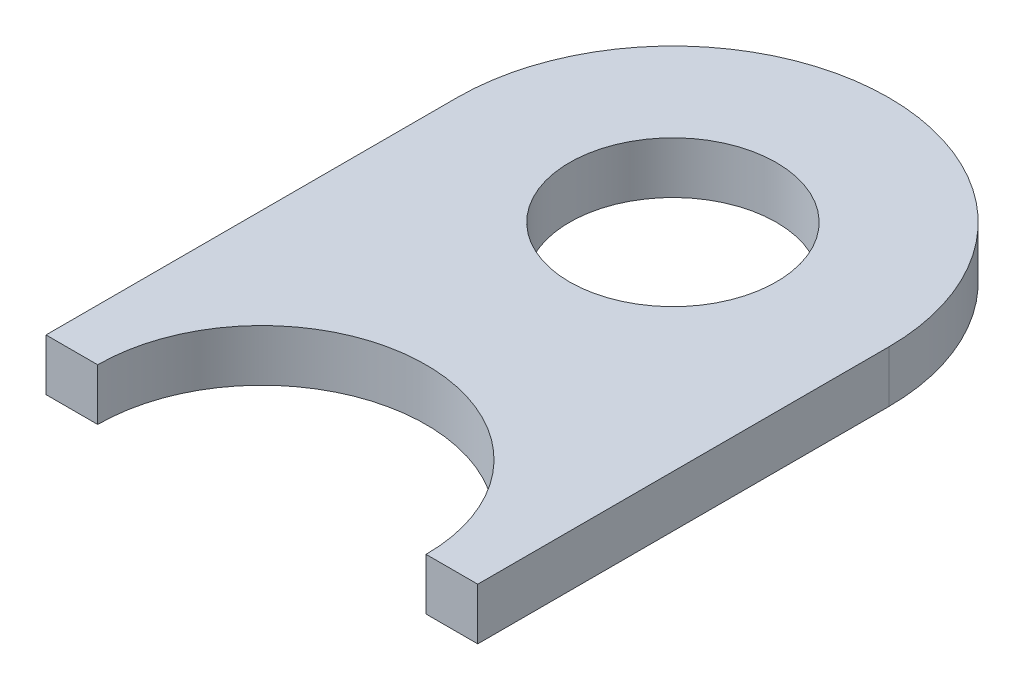
from build123d import *

# Parameters (mm, degrees)
SKETCH1_R           = 8
BOSS_EXTRUDE1_DEPTH = 4


with BuildPart() as part:
    # Sketch1 → Boss-Extrude1 (new body)
    with BuildSketch(Plane(origin=(0, 0, 0), x_dir=(1, 0, 0), z_dir=(0, 1, 0))):
        with BuildLine():
            Line((0, 0), (-4, 0))
            ThreePointArc((-4, 0), (-16.7, 12.7), (-29.4, 0))
            Line((-29.4, 0), (-33.4, 0))
            Line((-33.4, 0), (-33.4, 31.8))
            ThreePointArc((-33.4, 31.8), (-16.7, 48.5), (0, 31.8))
            Line((0, 31.8), (0, 0))
        make_face()
        with Locations((-16.7, 31.8)):
            Circle(SKETCH1_R, mode=Mode.SUBTRACT)
    extrude(amount=BOSS_EXTRUDE1_DEPTH)


solid = part.part
